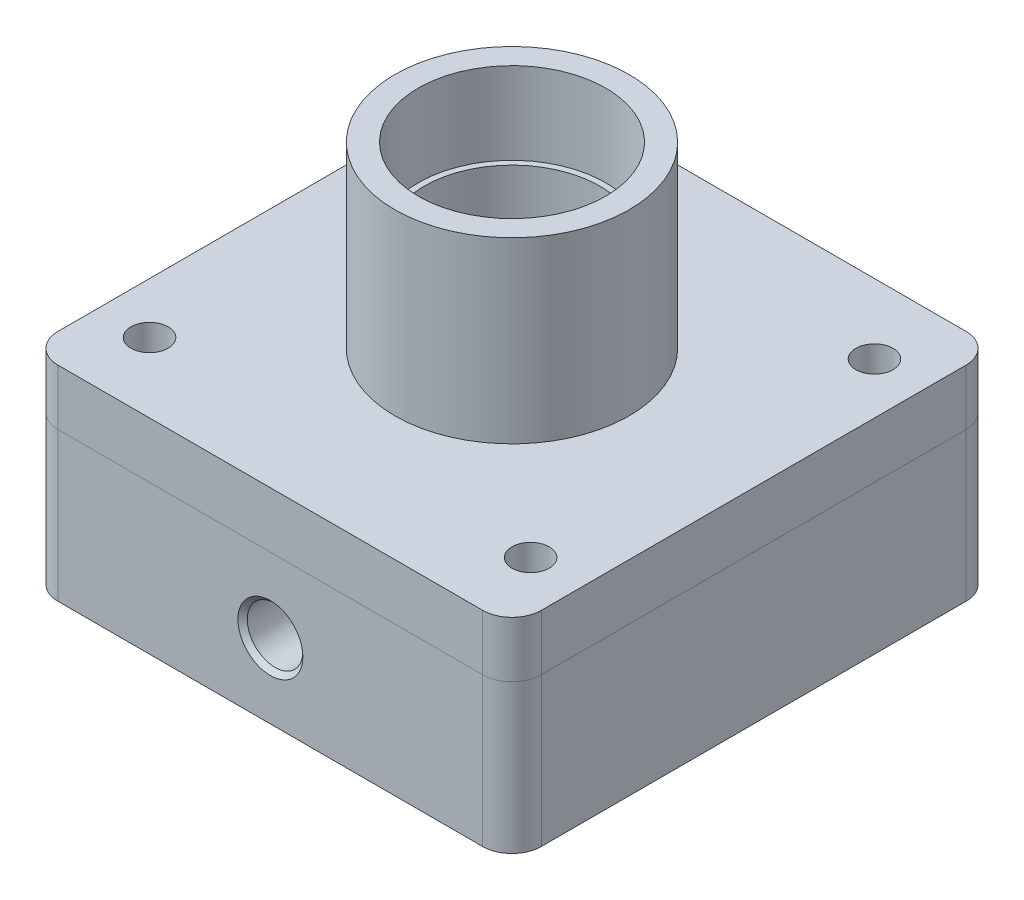
from build123d import *

# Parameters (mm, degrees)
SKETCH1_W                              = 165
SKETCH1_H                              = 165
BOSS_EXTRUDE1_DEPTH                    = 50.8
SKETCH2_R                              = 40
BOSS_EXTRUDE2_DEPTH                    = 80
SKETCH3_R                              = 32
CUT_EXTRUDE1_DEPTH                     = 28
SKETCH4_R                              = 30
CUT_EXTRUDE2_DEPTH                     = 22
FILLET1_R                              = 10
SKETCH5_R                              = 20
CUT_EXTRUDE3_DEPTH                     = 40
SKETCH6_R                              = 76.2
SKETCH6_R_2                            = 69.85
CUT_EXTRUDE4_DEPTH                     = 10
F_1_2_14_NPSM_TAPPED_HOLE2_D           = 18.9738
F_1_2_14_NPSM_TAPPED_HOLE2_DEPTH       = 47.25
F_1_2_14_NPSM_TAPPED_HOLE2_CSINK_D     = 22.1742
F_1_2_14_NPSM_TAPPED_HOLE2_CSINK_ANGLE = 90
F_1_2_14_NPSM_TAPPED_HOLE2_TIP         = 5.700304607
SKETCH12_R                             = 6.35
CUT_EXTRUDE5_DEPTH                     = 25
SKETCH20_R                             = 6.35
CUT_EXTRUDE6_DEPTH                     = 176.274470474
SKETCH24_R                             = 6.35
BOSS_EXTRUDE4_DEPTH                    = 19.05


with BuildPart() as part:
    # Sketch1 → Boss-Extrude1 (new body)
    with BuildSketch(Plane(origin=(0, 0, 0), x_dir=(1, 0, 0), z_dir=(0, 1, 0))):
        Rectangle(SKETCH1_W, SKETCH1_H)
    extrude(amount=BOSS_EXTRUDE1_DEPTH)

    # Sketch2 → Boss-Extrude2 (add)
    with BuildSketch(Plane(origin=(0, 50.8, 0), x_dir=(1, 0, 0), z_dir=(0, 1, 0))):
        with Locations(Location((0, 0, 0), (0, 0, 270))):
            Circle(SKETCH2_R)
    extrude(amount=BOSS_EXTRUDE2_DEPTH)

    # Sketch3 → Cut-Extrude1 (cut)
    with BuildSketch(Plane(origin=(0, 130.8, 0), x_dir=(1, 0, 0), z_dir=(0, 1, 0))):
        with Locations(Location((0, 0, 0), (0, 0, 270))):
            Circle(SKETCH3_R)
    extrude(amount=-CUT_EXTRUDE1_DEPTH, mode=Mode.SUBTRACT)

    # Sketch4 → Cut-Extrude2 (cut)
    with BuildSketch(Plane(origin=(0, 102.8, 0), x_dir=(1, 0, 0), z_dir=(0, 1, 0))):
        with Locations(Location((0, 0, 0), (0, 0, 270))):
            Circle(SKETCH4_R)
    extrude(amount=-CUT_EXTRUDE2_DEPTH, mode=Mode.SUBTRACT)

    # Fillet1
    fillet1_edges = [part.edges().sort_by_distance(p)[0] for p in [
        (82.5, 25.4, 82.5),
        (-82.5, 25.4, 82.5),
        (-82.5, 25.4, -82.5),
        (82.5, 25.4, -82.5),
    ]]
    fillet(fillet1_edges, radius=FILLET1_R)

    # Sketch5 → Cut-Extrude3 (cut)
    with BuildSketch(Plane.XZ):
        with Locations(Location((0, 0, 0), (0, 0, 270))):
            Circle(SKETCH5_R)
    extrude(amount=-CUT_EXTRUDE3_DEPTH, mode=Mode.SUBTRACT)

    # Sketch6 → Cut-Extrude4 (cut)
    with BuildSketch(Plane.XZ):
        with Locations(Location((0, 0, 0), (0, 0, 270))):
            Circle(SKETCH6_R)
        with Locations(Location((0, 0, 0), (0, 0, 270))):
            Circle(SKETCH6_R_2, mode=Mode.SUBTRACT)
    extrude(amount=-CUT_EXTRUDE4_DEPTH, mode=Mode.SUBTRACT)

    # 1/2-14 NPSM Tapped Hole2
    with Locations(Plane.XY.offset(82.5)):
        with Locations((0, 25.4)):
            CounterSinkHole(F_1_2_14_NPSM_TAPPED_HOLE2_D / 2, F_1_2_14_NPSM_TAPPED_HOLE2_CSINK_D / 2, depth=F_1_2_14_NPSM_TAPPED_HOLE2_DEPTH, counter_sink_angle=F_1_2_14_NPSM_TAPPED_HOLE2_CSINK_ANGLE)
            with Locations((0, 0, -(F_1_2_14_NPSM_TAPPED_HOLE2_DEPTH + F_1_2_14_NPSM_TAPPED_HOLE2_TIP / 2))):  # 118° drill point
                Cone(0, F_1_2_14_NPSM_TAPPED_HOLE2_D / 2, F_1_2_14_NPSM_TAPPED_HOLE2_TIP, mode=Mode.SUBTRACT)

    # Sketch12 → Cut-Extrude5 (cut)
    with BuildSketch(Plane.XZ):
        with Locations(Location((0, 50.5, 0), (0, 0, 270))):
            Circle(SKETCH12_R)
    extrude(amount=-CUT_EXTRUDE5_DEPTH, mode=Mode.SUBTRACT)

    # Sketch20 → Cut-Extrude6 (cut, through all)
    with BuildSketch(Plane.XZ):
        with Locations(Location((-65.055773782, 58.709140665, 0), (0, 0, 270))):
            Circle(SKETCH20_R)
        with Locations(Location((-65.055773782, -58.709140665, 0), (0, 0, 270))):
            Circle(SKETCH20_R)
        with Locations(Location((65.055773782, -58.709140665, 0), (0, 0, 270))):
            Circle(SKETCH20_R)
        with Locations(Location((65.055773782, 58.709140665, 0), (0, 0, 270))):
            Circle(SKETCH20_R)
    extrude(amount=-CUT_EXTRUDE6_DEPTH, mode=Mode.SUBTRACT)


with BuildPart() as body_2:
    # Sketch24 → Boss-Extrude4 (new body)
    with BuildSketch(Plane(origin=(0, 50.8, 0), x_dir=(1, 0, 0), z_dir=(0, 1, 0))):
        with BuildLine():
            Line((-72.5, -82.5), (72.5, -82.5))
            ThreePointArc((72.5, -82.5), (79.571067812, -79.571067812), (82.5, -72.5))
            Line((82.5, -72.5), (82.5, 72.5))
            ThreePointArc((82.5, 72.5), (79.571067812, 79.571067812), (72.5, 82.5))
            Line((72.5, 82.5), (-72.5, 82.5))
            ThreePointArc((-72.5, 82.5), (-79.571067812, 79.571067812), (-82.5, 72.5))
            Line((-82.5, 72.5), (-82.5, -72.5))
            ThreePointArc((-82.5, -72.5), (-79.571067812, -79.571067812), (-72.5, -82.5))
        make_face()
        with Locations(Location((-65.055773782, -58.709140665, 0), (0, 0, 90))):
            Circle(SKETCH24_R, mode=Mode.SUBTRACT)
        with Locations(Location((-65.055773782, 58.709140665, 0), (0, 0, 90))):
            Circle(SKETCH24_R, mode=Mode.SUBTRACT)
        with Locations(Location((65.055773782, -58.709140665, 0), (0, 0, 90))):
            Circle(SKETCH24_R, mode=Mode.SUBTRACT)
        with Locations(Location((65.055773782, 58.709140665, 0), (0, 0, 90))):
            Circle(SKETCH24_R, mode=Mode.SUBTRACT)
    extrude(amount=BOSS_EXTRUDE4_DEPTH)


solid = Compound([part.part, body_2.part])
